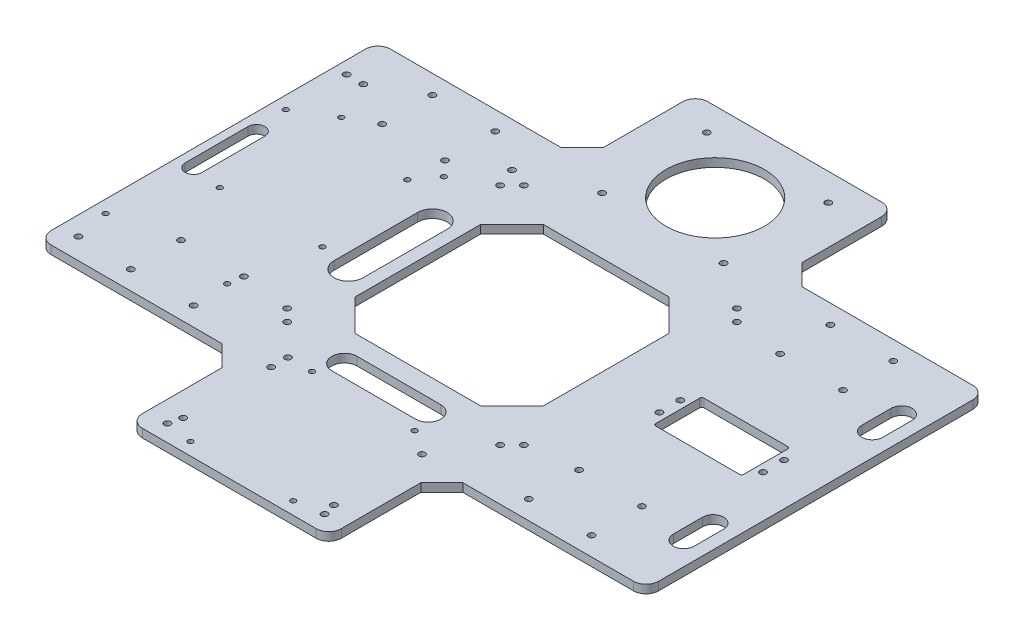
from build123d import *

# Parameters (mm, degrees)
EXTRUDE_1_DEPTH      = 4
SKETCH_2_R           = 1.5
CUT_EXTRUDE_1_DEPTH  = 4
SKETCH_3_R           = 23.5
SKETCH_3_R_2         = 1.5
CUT_EXTRUDE_2_DEPTH  = 4
SKETCH_4_W           = 90
SKETCH_4_H           = 90
CUT_EXTRUDE_3_DEPTH  = 4
FILLET_3_R           = 6
CHAMFER_1_SIZE       = 10
CUT_EXTRUDE_6_DEPTH  = 4
CHAMFER_2_SIZE       = 15
SKETCH_8_R           = 1.5
CUT_EXTRUDE_7_DEPTH  = 4
SKETCH_9_R           = 1.5
CUT_EXTRUDE_8_DEPTH  = 4
CUT_EXTRUDE_9_DEPTH  = 10
SKETCH_14_R          = 1.5
SKETCH_14_R_2        = 1.25
CUT_EXTRUDE_10_DEPTH = 10
SKETCH_15_R          = 1.5
SKETCH_15_W          = 42
SKETCH_15_H          = 23
CUT_EXTRUDE_11_DEPTH = 10
FILLET_4_R           = 1
SKETCH_16_R          = 1.25
CUT_EXTRUDE_12_DEPTH = 10
SKETCH_23_R          = 1.25
CUT_EXTRUDE_14_DEPTH = 10
SKETCH_24_R          = 1.5
CUT_EXTRUDE_15_DEPTH = 10
SKETCH_20_R          = 1.5
CUT_EXTRUDE_16_DEPTH = 10


with BuildPart() as part:
    # 草图1 → 凸台-拉伸1 (new body)
    with BuildSketch(Plane(origin=(0, 0, 0), x_dir=(1, 0, 0), z_dir=(0, 1, 0))):
        Polygon((-47.5, -81), (-47.5, -135), (47.5, -135), (47.5, -81), (145, -81), (145, 81), (47.5, 81), (47.5, 135), (-47.5, 135), (-47.5, 81), (-145, 81), (-145, -81), align=None)
    extrude(amount=EXTRUDE_1_DEPTH)

    # 草图2 → 切除-拉伸1 (cut)
    with BuildSketch(Plane(origin=(0, 4, 0), x_dir=(1, 0, 0), z_dir=(0, 1, 0))):
        with Locations(Location((110, 72, 0), (0, 0, 270))):
            Circle(SKETCH_2_R)
        with Locations(Location((80, 72, 0), (0, 0, 270))):
            Circle(SKETCH_2_R)
        with Locations(Location((80, 48, 0), (0, 0, 270))):
            Circle(SKETCH_2_R)
        with Locations(Location((110, 48, 0), (0, 0, 270))):
            Circle(SKETCH_2_R)
        with Locations(Location((110, -48, 0), (0, 0, 90))):
            Circle(SKETCH_2_R)
        with Locations(Location((110, -72, 0), (0, 0, 90))):
            Circle(SKETCH_2_R)
        with Locations(Location((80, -48, 0), (0, 0, 90))):
            Circle(SKETCH_2_R)
        with Locations(Location((80, -72, 0), (0, 0, 90))):
            Circle(SKETCH_2_R)
        with Locations(Location((-80, -72, 0), (0, 0, 270))):
            Circle(SKETCH_2_R)
        with Locations(Location((-80, -48, 0), (0, 0, 270))):
            Circle(SKETCH_2_R)
        with Locations(Location((-110, -72, 0), (0, 0, 270))):
            Circle(SKETCH_2_R)
        with Locations(Location((-110, -48, 0), (0, 0, 270))):
            Circle(SKETCH_2_R)
        with Locations(Location((-110, 48, 0), (0, 0, 90))):
            Circle(SKETCH_2_R)
        with Locations(Location((-80, 48, 0), (0, 0, 90))):
            Circle(SKETCH_2_R)
        with Locations(Location((-80, 72, 0), (0, 0, 90))):
            Circle(SKETCH_2_R)
        with Locations(Location((-110, 72, 0), (0, 0, 90))):
            Circle(SKETCH_2_R)
    extrude(amount=-CUT_EXTRUDE_1_DEPTH, mode=Mode.SUBTRACT)

    # 草图3 → 切除-拉伸2 (cut)
    with BuildSketch(Plane(origin=(0, 4, 0), x_dir=(1, 0, 0), z_dir=(0, 1, 0))):
        with Locations(Location((0, 97, 0), (0, 0, 270))):
            Circle(SKETCH_3_R)
        with Locations(Location((29, 122, 0), (0, 0, 270))):
            Circle(SKETCH_3_R_2)
        with Locations(Location((29, 72, 0), (0, 0, 90))):
            Circle(SKETCH_3_R_2)
        with Locations(Location((-29, 72, 0), (0, 0, 270))):
            Circle(SKETCH_3_R_2)
        with Locations(Location((-29, 122, 0), (0, 0, 90))):
            Circle(SKETCH_3_R_2)
    extrude(amount=-CUT_EXTRUDE_2_DEPTH, mode=Mode.SUBTRACT)

    # 草图4 → 切除-拉伸3 (cut)
    with BuildSketch(Plane(origin=(0, 4, 0), x_dir=(1, 0, 0), z_dir=(0, 1, 0))):
        Rectangle(SKETCH_4_W, SKETCH_4_H)
    extrude(amount=-CUT_EXTRUDE_3_DEPTH, mode=Mode.SUBTRACT)

    # 圆角3
    fillet_3_edges = [part.edges().sort_by_distance(p)[0] for p in [
        (-145, 2, 81),
        (-145, 2, -81),
        (-47.5, 2, -135),
        (47.5, 2, -135),
        (145, 2, -81),
        (145, 2, 81),
        (47.5, 2, 135),
        (-47.5, 2, 135),
    ]]
    fillet(fillet_3_edges, radius=FILLET_3_R)

    # 倒角1
    chamfer_1_edges = [part.edges().sort_by_distance(p)[0] for p in [
        (-47.5, 2, 81),
        (-47.5, 2, -81),
        (47.5, 2, -81),
        (47.5, 2, 81),
    ]]
    chamfer(chamfer_1_edges, length=CHAMFER_1_SIZE)

    # 草图7 → 切除-拉伸6 (cut)
    with BuildSketch(Plane(origin=(0, 4, 0), x_dir=(1, 0, 0), z_dir=(0, 1, 0))):
        with BuildLine():
            Line((-65, -20), (-65, 20))
            ThreePointArc((-65, 20), (-58, 27), (-51, 20))
            Line((-51, 20), (-51, -20))
            ThreePointArc((-51, -20), (-58, -27), (-65, -20))
        make_face()
        with BuildLine():
            Line((-141, -15), (-141, 15))
            ThreePointArc((-141, 15), (-137, 19), (-133, 15))
            Line((-133, 15), (-133, -15))
            ThreePointArc((-133, -15), (-137, -19), (-141, -15))
        make_face()
        with BuildLine():
            Line((129, 38), (129, 52))
            ThreePointArc((129, 52), (134, 57), (139, 52))
            Line((139, 52), (139, 38))
            ThreePointArc((139, 38), (134, 33), (129, 38))
        make_face()
        with BuildLine():
            Line((129, -38), (129, -52))
            ThreePointArc((129, -52), (134, -57), (139, -52))
            Line((139, -52), (139, -38))
            ThreePointArc((139, -38), (134, -33), (129, -38))
        make_face()
    extrude(amount=-CUT_EXTRUDE_6_DEPTH, mode=Mode.SUBTRACT)

    # 倒角2
    chamfer_2_edges = [part.edges().sort_by_distance(p)[0] for p in [
        (45, 2, -45),
        (45, 2, 45),
        (-45, 2, 45),
        (-45, 2, -45),
    ]]
    chamfer(chamfer_2_edges, length=CHAMFER_2_SIZE)

    # 草图8 → 切除-拉伸7 (cut)
    with BuildSketch(Plane(origin=(0, 4, 0), x_dir=(1, 0, 0), z_dir=(0, 1, 0))):
        with Locations(Location((-139, 60, 0), (0, 0, 270))):
            Circle(SKETCH_8_R)
        with Locations(Location((-131, 60, 0), (0, 0, 270))):
            Circle(SKETCH_8_R)
    extrude(amount=-CUT_EXTRUDE_7_DEPTH, mode=Mode.SUBTRACT)

    # 草图9 → 切除-拉伸8 (cut)
    with BuildSketch(Plane(origin=(0, 4, 0), x_dir=(1, 0, 0), z_dir=(0, 1, 0))):
        with Locations(Location((50.843145751, 56.5, 0), (0, 0, 270))):
            Circle(SKETCH_9_R)
        with Locations(Location((56.5, 50.843145751, 0), (0, 0, 270))):
            Circle(SKETCH_9_R)
        with Locations(Location((56.5, -50.843145751, 0), (0, 0, 90))):
            Circle(SKETCH_9_R)
        with Locations(Location((50.843145751, -56.5, 0), (0, 0, 90))):
            Circle(SKETCH_9_R)
        with Locations(Location((-50.843145751, -56.5, 0), (0, 0, 270))):
            Circle(SKETCH_9_R)
        with Locations(Location((-56.5, -50.843145751, 0), (0, 0, 270))):
            Circle(SKETCH_9_R)
        with Locations(Location((-56.5, 50.843145751, 0), (0, 0, 90))):
            Circle(SKETCH_9_R)
        with Locations(Location((-50.843145751, 56.5, 0), (0, 0, 90))):
            Circle(SKETCH_9_R)
        with Locations(Location((-37.5, -127, 0), (0, 0, 270))):
            Circle(SKETCH_9_R)
        with Locations(Location((37.5, -127, 0), (0, 0, 90))):
            Circle(SKETCH_9_R)
    extrude(amount=-CUT_EXTRUDE_8_DEPTH, mode=Mode.SUBTRACT)

    # 草图12 → 切除-拉伸9 (cut)
    with BuildSketch(Plane(origin=(0, 4, 0), x_dir=(1, 0, 0), z_dir=(0, 1, 0))):
        with BuildLine():
            Line((-20, -54), (20, -54))
            ThreePointArc((20, -54), (26, -60), (20, -66))
            Line((20, -66), (-20, -66))
            ThreePointArc((-20, -66), (-26, -60), (-20, -54))
        make_face()
    extrude(amount=-CUT_EXTRUDE_9_DEPTH, mode=Mode.SUBTRACT)

    # 草图14 → 切除-拉伸10 (cut)
    with BuildSketch(Plane(origin=(0, 4, 0), x_dir=(1, 0, 0), z_dir=(0, 1, 0))):
        with Locations(Location((36, -79, 0), (0, 0, 270))):
            Circle(SKETCH_14_R)
        with Locations(Location((36, -121, 0), (0, 0, 270))):
            Circle(SKETCH_14_R)
        with Locations(Location((-36, -121, 0), (0, 0, 270))):
            Circle(SKETCH_14_R)
        with Locations(Location((-36, -79, 0), (0, 0, 270))):
            Circle(SKETCH_14_R)
        with Locations(Location((-24.5, -71, 0), (0, 0, 270))):
            Circle(SKETCH_14_R_2)
        with Locations(Location((24.5, -71, 0), (0, 0, 270))):
            Circle(SKETCH_14_R_2)
        with Locations(Location((24.5, -129, 0), (0, 0, 270))):
            Circle(SKETCH_14_R_2)
        with Locations(Location((-24.5, -129, 0), (0, 0, 270))):
            Circle(SKETCH_14_R_2)
    extrude(amount=-CUT_EXTRUDE_10_DEPTH, mode=Mode.SUBTRACT)

    # 草图15 → 切除-拉伸11 (cut)
    with BuildSketch(Plane(origin=(0, 4, 0), x_dir=(1, 0, 0), z_dir=(0, 1, 0))):
        with Locations(Location((75.36, 5, 0), (0, 0, 270))):
            Circle(SKETCH_15_R)
        with Locations(Location((75.36, -5, 0), (0, 0, 270))):
            Circle(SKETCH_15_R)
        with Locations(Location((124.86, -5, 0), (0, 0, 270))):
            Circle(SKETCH_15_R)
        with Locations(Location((124.86, 5, 0), (0, 0, 270))):
            Circle(SKETCH_15_R)
        with Locations((100.11, 0)):
            Rectangle(SKETCH_15_W, SKETCH_15_H)
    extrude(amount=-CUT_EXTRUDE_11_DEPTH, mode=Mode.SUBTRACT)

    # 圆角4
    fillet_4_edges = [part.edges().sort_by_distance(p)[0] for p in [
        (121.11, 2, -11.5),
        (121.11, 2, 11.5),
        (79.11, 2, 11.5),
        (79.11, 2, -11.5),
    ]]
    fillet(fillet_4_edges, radius=FILLET_4_R)

    # 草图16 → 切除-拉伸12 (cut)
    with BuildSketch(Plane(origin=(0, 4, 0), x_dir=(1, 0, 0), z_dir=(0, 1, 0))):
        with Locations(Location((-73.5, 41, 0), (0, 0, 270))):
            Circle(SKETCH_16_R)
        with Locations(Location((-122.5, 41, 0), (0, 0, 270))):
            Circle(SKETCH_16_R)
        with Locations(Location((-73.5, -17, 0), (0, 0, 270))):
            Circle(SKETCH_16_R)
        with Locations(Location((-122.5, -17, 0), (0, 0, 270))):
            Circle(SKETCH_16_R)
    extrude(amount=-CUT_EXTRUDE_12_DEPTH, mode=Mode.SUBTRACT)

    # 草图23 → 切除-拉伸14 (cut)
    with BuildSketch(Plane(origin=(0, 4, 0), x_dir=(1, 0, 0), z_dir=(0, 1, 0))):
        with Locations(Location((-81, 31, 0), (0, 0, 270))):
            Circle(SKETCH_23_R)
        with Locations(Location((-139, 31, 0), (0, 0, 270))):
            Circle(SKETCH_23_R)
        with Locations(Location((-81, -55, 0), (0, 0, 270))):
            Circle(SKETCH_23_R)
        with Locations(Location((-139, -55, 0), (0, 0, 270))):
            Circle(SKETCH_23_R)
    extrude(amount=-CUT_EXTRUDE_14_DEPTH, mode=Mode.SUBTRACT)

    # 草图24 → 切除-拉伸15 (cut)
    with BuildSketch(Plane(origin=(0, 4, 0), x_dir=(1, 0, 0), z_dir=(0, 1, 0))):
        with Locations(Location((-136, -71, 0), (0, 0, 270))):
            Circle(SKETCH_24_R)
        with Locations(Location((-36, -71, 0), (0, 0, 270))):
            Circle(SKETCH_24_R)
        with Locations(Location((-36, -121, 0), (0, 0, 270))):
            Circle(SKETCH_24_R)
    extrude(amount=-CUT_EXTRUDE_15_DEPTH, mode=Mode.SUBTRACT)

    # 草图20 → 切除-拉伸16 (cut)
    with BuildSketch(Plane(origin=(0, 4, 0), x_dir=(1, 0, 0), z_dir=(0, 1, 0))):
        with Locations(Location((-60, 60, 0), (0, 0, 270))):
            Circle(SKETCH_20_R)
    extrude(amount=-CUT_EXTRUDE_16_DEPTH, mode=Mode.SUBTRACT)


solid = part.part
